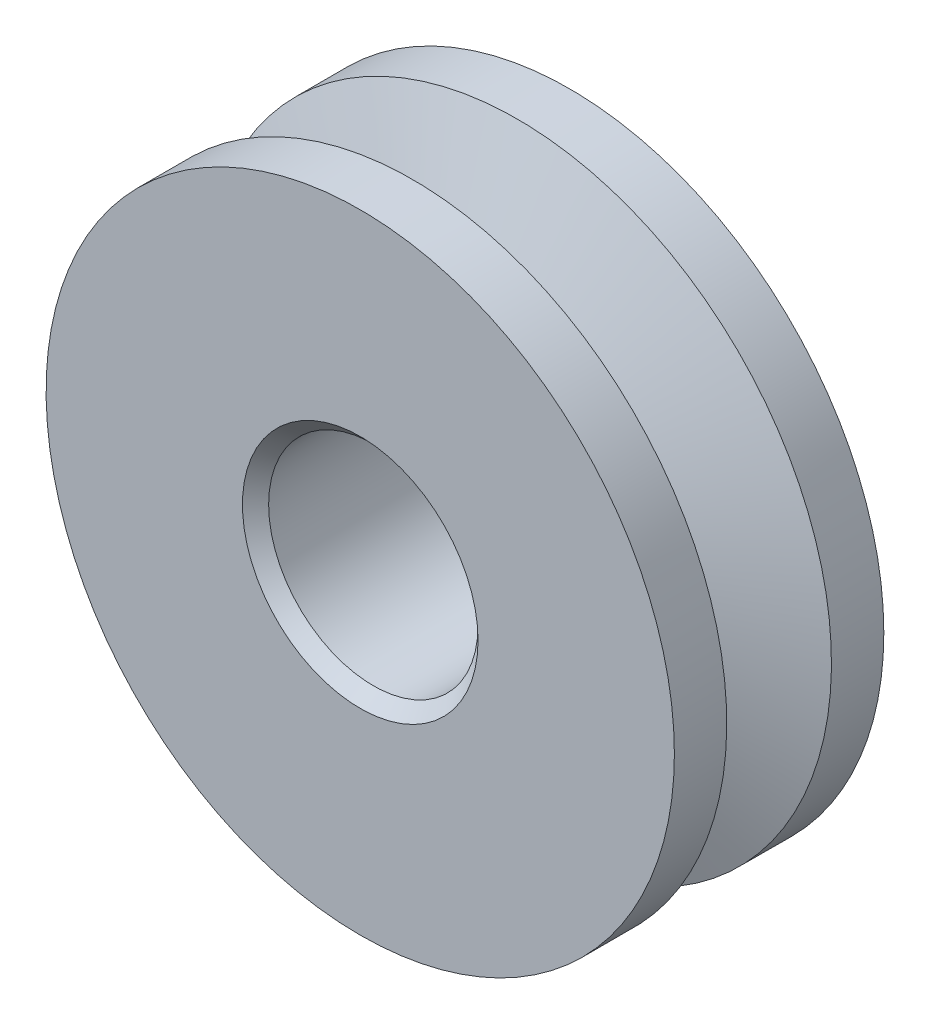
from build123d import *

# Parameters (mm, degrees)
SKETCH1_R      = 19.05
SKETCH1_R_2    = 6.35
EXTRUDE1_DEPTH = 6.35
CHAMFER1_SIZE  = 0.79375


with BuildPart() as part:
    # Sketch1 → Extrude1 (new, symmetric)
    with BuildSketch(Plane.XY):
        Circle(SKETCH1_R)
        Circle(SKETCH1_R_2, mode=Mode.SUBTRACT)
    extrude(amount=EXTRUDE1_DEPTH, both=True)

    # Chamfer1
    chamfer1_edges = [part.edges().sort_by_distance(p)[0] for p in [
        (-6.35, 0, -6.35),
        (-6.35, 0, 6.35),
    ]]
    chamfer(chamfer1_edges, length=CHAMFER1_SIZE)

    # Sketch2 → Cut-Revolve1 (revolve, cut)
    with BuildSketch(Plane(origin=(0, 0, 0), x_dir=(0, 0, -1), z_dir=(1, 0, 0)), mode=Mode.PRIVATE) as cut_revolve1_sk:
        Polygon((-3.175, 19.05), (3.175, 19.05), (0.863789012, 12.7), (-0.863789012, 12.7), align=None)
    revolve(cut_revolve1_sk.sketch.rotate(Axis((0, 0, 6.35), (0, 0, -1)), 180), axis=Axis((0, 0, 6.35), (0, 0, -1)), mode=Mode.SUBTRACT)


solid = part.part
